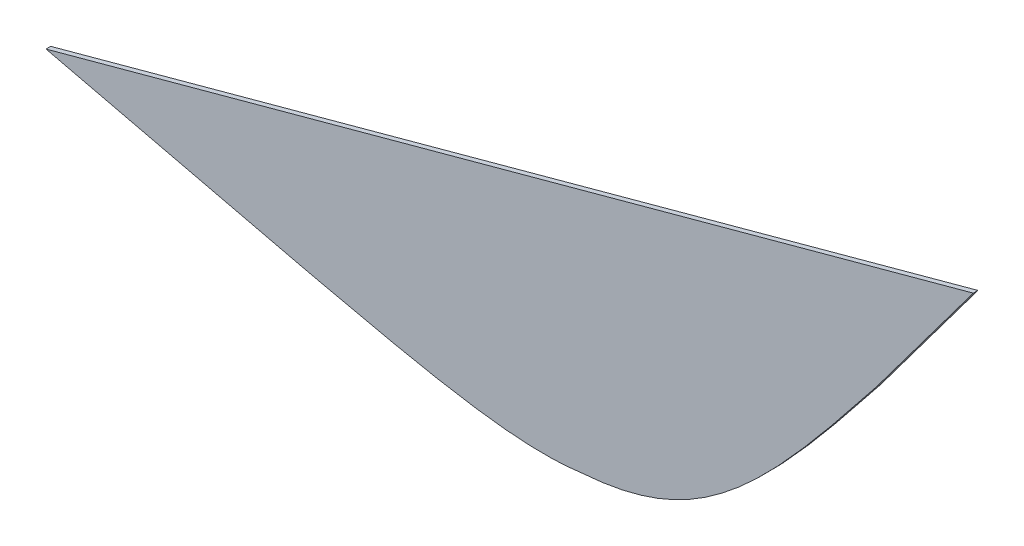
from build123d import *

# Parameters (mm, degrees)
EXTRUDE_1_DEPTH          = 5
CUT_EXTRUDE_1_DEPTH      = 1202.322110811
CUT_EXTRUDE_1_DEPTH_BACK = 1202.322110811
EXTRUDE_2_DEPTH          = 10


with BuildPart() as part:
    # Эскиз11 → Бобышка-Вытянуть1 (new, symmetric)
    with BuildSketch(Plane.XY):
        with BuildLine():
            Line((636.463912705, 976.146466683), (700.205604925, 770.085305884))
            add(Edge.make_bspline(
                [(700.205604925, 770.085305884), (141.848194954, 128.23481722), (116.561380271, 120.122243094), (-589.536273057, 282.297875154)],
                knots=[0, 0, 0, 0, 1, 1, 1, 1], degree=3))
            Line((-589.536273057, 282.297875154), (-589.536273057, 976.146466683))
            Line((-589.536273057, 976.146466683), (636.463912705, 976.146466683))
        make_face()
    extrude(amount=EXTRUDE_1_DEPTH, both=True)

    # Эскиз12 → Вырез-Вытянуть1 (cut, two sides: drawn at the far end of the back side and taken through both)
    with BuildSketch(Plane.XY.offset(-CUT_EXTRUDE_1_DEPTH_BACK)):
        Polygon((-700.700191259, 528.942112061), (706.16734826, 911.673616779), (340.903623972, 1222.525422138), (-820.682545159, 1079.972181823), align=None)
    extrude(amount=CUT_EXTRUDE_1_DEPTH + CUT_EXTRUDE_1_DEPTH_BACK, mode=Mode.SUBTRACT)


with BuildPart() as cut_extrude_1_piece_1:
    # of the separate pieces the step leaves, piece 1, a body of its own (cut_extrude_1_pieces)
    add(part.part.solids().sort_by_distance((660.269941789, 899.187449498, 5))[0])

    # Эскиз14 → Бобышка-Вытянуть2 (add)
    with BuildSketch(Plane(origin=(0, 0, -5), x_dir=(-1, 0, 0), z_dir=(0, 0, -1))):
        with BuildLine():
            Line((1133.941311309, 411.08096229), (589.536273057, 282.297875154))
            add(Edge.make_bspline(
                [(-637.785646163, 672.312444588), (-248.934023891, 179.435642483), (-152.966629698, 110.557627429), (589.536273057, 282.297875154)],
                knots=[0, 0, 0, 0, 1, 1, 1, 1], degree=3))
            Line((-637.785646163, 672.312444588), (-844.917078579, 949.419809347))
            Line((-844.917078579, 949.419809347), (-660.269941789, 899.187449498))
            Line((-660.269941789, 899.187449498), (1133.941311309, 411.08096229))
        make_face()
    extrude(amount=-EXTRUDE_2_DEPTH)


with BuildPart() as cut_extrude_1_piece_2:
    # of the separate pieces the step leaves, piece 2, a body of its own (cut_extrude_1_pieces)
    add(part.part.solids().sort_by_distance((636.463912705, 976.146466683, -5))[0])


solid = cut_extrude_1_piece_1.part
